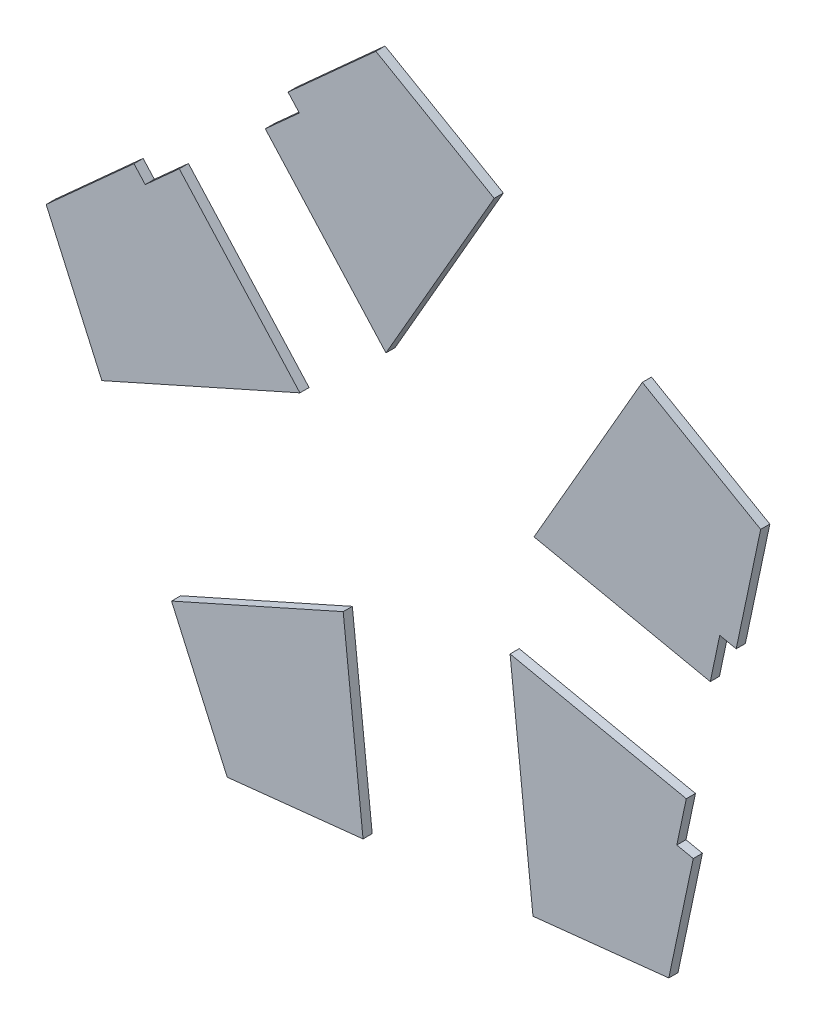
from build123d import *

# Parameters (mm, degrees)
BOSS_EXTRUDE1_DEPTH   = 3
BOSS_EXTRUDE1_2_DEPTH = 3
BOSS_EXTRUDE1_3_DEPTH = 3
BOSS_EXTRUDE1_4_DEPTH = 3
BOSS_EXTRUDE1_5_DEPTH = 3


with BuildPart() as part:
    # Sketch15 → Boss-Extrude1 (new body)
    with BuildSketch(Plane.XY):
        Polygon((-61.688025962, -107.113154668), (-17.244174379, -102.39349725), (-23.74022552, -41.221783455), (-79.910592339, -66.30299436), align=None)
    extrude(amount=BOSS_EXTRUDE1_DEPTH)


with BuildPart() as body_2:
    # Sketch15 → Boss-Extrude1 2 (new body)
    with BuildSketch(Plane.XY):
        Polygon((-92.206166548, 51.491152029), (-120.9333121, 25.569013955), (-102.710745723, -15.241146353), (-37.89950418, 13.698390813), (-77.385194882, 57.456786854), (-88.521546505, 47.4078231), align=None)
    extrude(amount=BOSS_EXTRUDE1_2_DEPTH)


with BuildPart() as body_3:
    # Sketch15 → Boss-Extrude1 3 (new body)
    with BuildSketch(Plane.XY):
        Polygon((-13.052871288, 122.915674351), (25.677104965, 100.610516894), (-9.746057716, 39.102847555), (-49.231748421, 82.861243593), (-38.095396799, 92.910207346), (-41.780016842, 96.993536275), align=None)
    extrude(amount=BOSS_EXTRUDE1_3_DEPTH)


with BuildPart() as body_4:
    # Sketch15 → Boss-Extrude1 4 (new body)
    with BuildSketch(Plane.XY):
        Polygon((104.862095509, 12.540207816), (112.866193993, 50.397050544), (74.13621774, 72.702208001), (38.71305506, 11.194538662), (96.37818973, -0.997640709), (99.481054752, 13.677924991), align=None)
    extrude(amount=BOSS_EXTRUDE1_4_DEPTH)


with BuildPart() as body_5:
    # Sketch15 → Boss-Extrude1 5 (new body)
    with BuildSketch(Plane.XY):
        Polygon((30.868803436, -25.906279208), (88.533938106, -38.098458575), (85.431073084, -52.774024276), (90.812113841, -53.911741451), (82.808015356, -91.768584182), (38.364163773, -96.4882416), (37.783364065, -91.018993782), align=None)
    extrude(amount=BOSS_EXTRUDE1_5_DEPTH)


solid = Compound([part.part, body_2.part, body_3.part, body_4.part, body_5.part])
